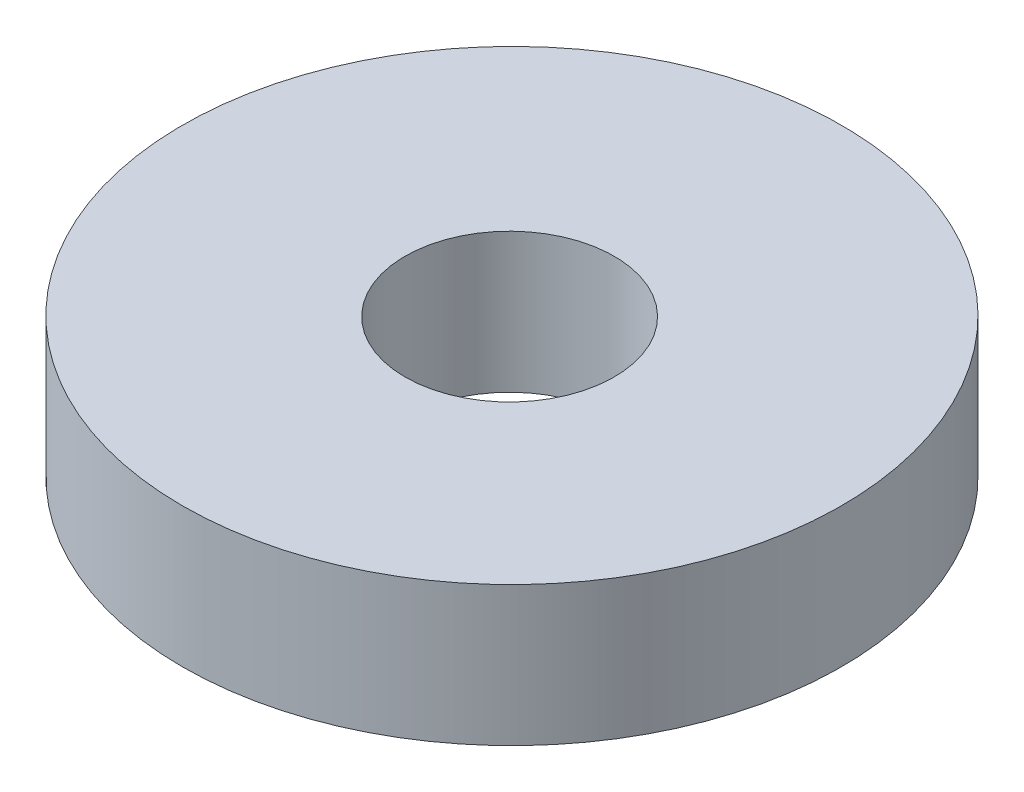
from build123d import *

# Parameters (mm, degrees)
SKETCH1_R           = 47.25
SKETCH1_R_2         = 15
BOSS_EXTRUDE1_DEPTH = 10


with BuildPart() as part:
    # Sketch1 → Boss-Extrude1 (new, symmetric)
    with BuildSketch(Plane(origin=(0, 0, 0), x_dir=(1, 0, 0), z_dir=(0, 1, 0))):
        with Locations(Location((0.029853375, 0.303152688, 0), (0, 0, 270))):
            Circle(SKETCH1_R)
        with Locations(Location((0, 0, 0), (0, 0, 270))):
            Circle(SKETCH1_R_2, mode=Mode.SUBTRACT)
    extrude(amount=BOSS_EXTRUDE1_DEPTH, both=True)


solid = part.part
